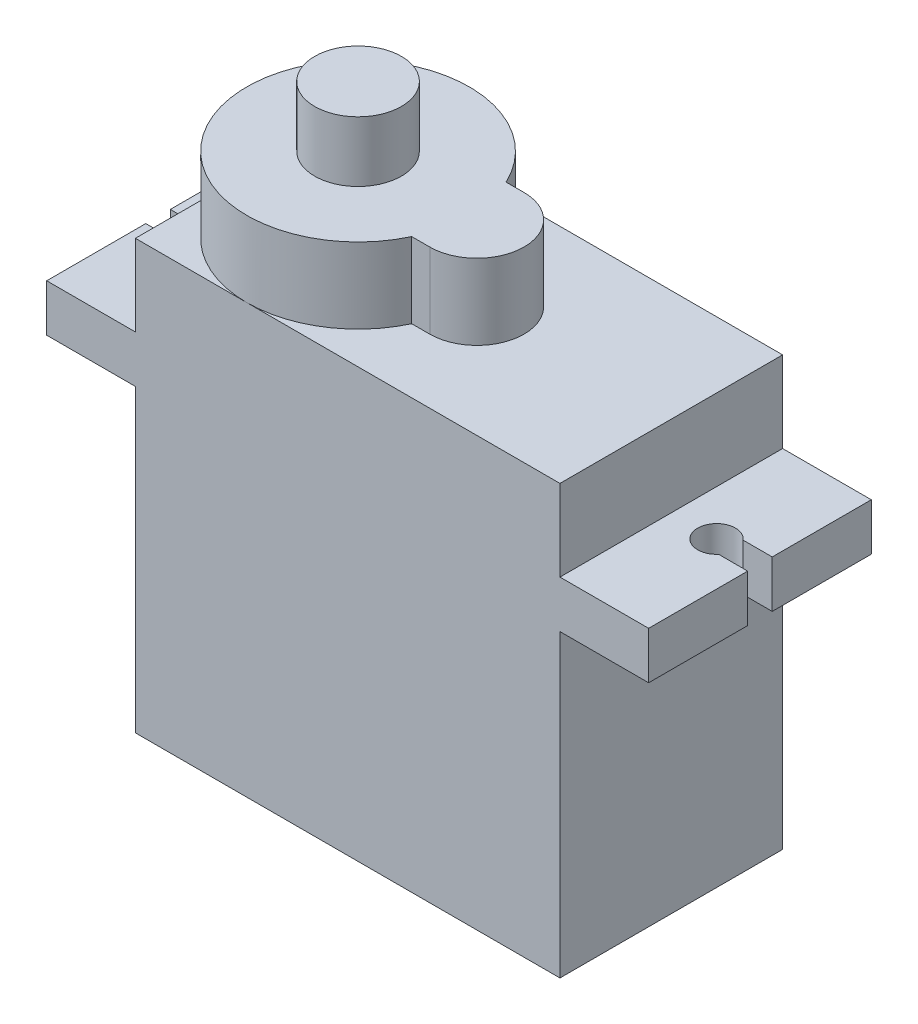
from build123d import *

# Parameters (mm, degrees)
BOSS_EXTRUDE1_DEPTH = 11.8
BOSS_EXTRUDE2_DEPTH = 4
CUT_EXTRUDE1_DEPTH  = 31.148507426
SKETCH4_R           = 2.3
BOSS_EXTRUDE4_DEPTH = 3.2


with BuildPart() as part:
    # Sketch1 → Boss-Extrude1 (new body)
    with BuildSketch(Plane.XY):
        Polygon((-11.25, 0), (11.25, 0), (11.25, 15.9), (15.95, 15.9), (15.95, 18.4), (11.25, 18.4), (11.25, 22.7), (-11.25, 22.7), (-11.25, 18.4), (-15.95, 18.4), (-15.95, 15.9), (-11.25, 15.9), align=None)
    extrude(amount=BOSS_EXTRUDE1_DEPTH)

    # Sketch2 → Boss-Extrude2 (add)
    with BuildSketch(Plane(origin=(0, 22.7, 0), x_dir=(1, 0, 0), z_dir=(0, 1, 0))):
        with BuildLine():
            Line((0.95, -8.4), (-0.005844314, -8.4))
            ThreePointArc((-0.005844314, -8.4), (-11.25, -5.9), (-0.005844314, -3.4))
            Line((-0.005844314, -3.4), (0.95, -3.4))
            ThreePointArc((0.95, -3.4), (3.45, -5.9), (0.95, -8.4))
        make_face()
    extrude(amount=BOSS_EXTRUDE2_DEPTH)

    # Sketch3 → Cut-Extrude1 (cut, through all)
    with BuildSketch(Plane(origin=(0, 22.7, 0), x_dir=(1, 0, 0), z_dir=(0, 1, 0))):
        with BuildLine():
            Line((-15.95, -5.25), (-14.409934208, -5.25))
            ThreePointArc((-14.409934208, -5.25), (-12.65, -5.9), (-14.409934208, -6.55))
            Line((-14.409934208, -6.55), (-15.95, -6.55))
            Line((-15.95, -6.55), (-15.95, -5.25))
        make_face()
        with BuildLine():
            Line((15.95, -6.55), (15.95, -5.25))
            Line((15.95, -5.25), (14.409934208, -5.25))
            ThreePointArc((14.409934208, -5.25), (12.65, -5.9), (14.409934208, -6.55))
            Line((14.409934208, -6.55), (15.95, -6.55))
        make_face()
    extrude(amount=-CUT_EXTRUDE1_DEPTH, mode=Mode.SUBTRACT)

    # Sketch4 → Boss-Extrude4 (add)
    with BuildSketch(Plane(origin=(0, 26.7, 0), x_dir=(1, 0, 0), z_dir=(0, 1, 0))):
        with Locations(Location((-5.35, -5.9, 0), (0, 0, 180))):
            Circle(SKETCH4_R)
    extrude(amount=BOSS_EXTRUDE4_DEPTH)


solid = part.part
